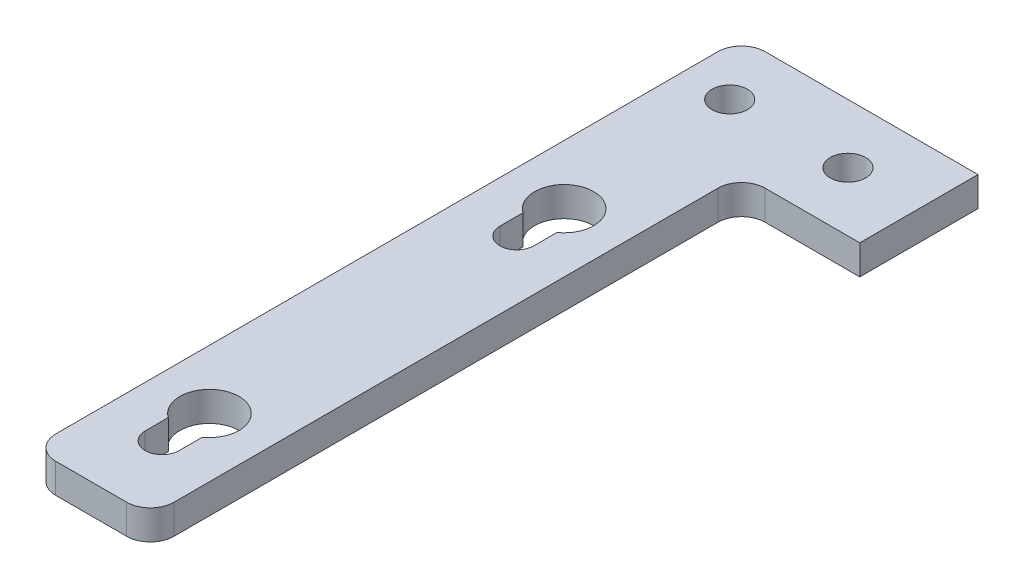
from build123d import *

# Parameters (mm, degrees)
BOSS_EXTRUDE1_DEPTH = 3.175
SKETCH2_R           = 1.905
CUT_EXTRUDE1_DEPTH  = 3.175
FILLET3_R           = 2.54


with BuildPart() as part:
    # Sketch1 → Boss-Extrude1 (new body)
    with BuildSketch(Plane(origin=(0, 0, 0), x_dir=(1, 0, 0), z_dir=(0, 1, 0))):
        Polygon((0, 76.2), (0, 0), (12.7, 0), (12.7, 63.5), (25.4, 63.5), (25.4, 76.2), align=None)
    extrude(amount=BOSS_EXTRUDE1_DEPTH)

    # Sketch2 → Cut-Extrude1 (cut)
    with BuildSketch(Plane(origin=(0, 3.175, 0), x_dir=(1, 0, 0), z_dir=(0, 1, 0))):
        with BuildLine():
            Line((4.5212, 48.204597226), (4.5212, 45.72))
            ThreePointArc((4.5212, 45.72), (6.35, 43.8912), (8.1788, 45.72))
            Line((8.1788, 45.72), (8.1788, 48.204597226))
            ThreePointArc((8.1788, 48.204597226), (6.35, 53.975), (4.5212, 48.204597226))
        make_face()
        with BuildLine():
            Line((4.5212, 10.104597226), (4.5212, 7.62))
            ThreePointArc((4.5212, 7.62), (6.35, 5.7912), (8.1788, 7.62))
            Line((8.1788, 7.62), (8.1788, 10.104597226))
            ThreePointArc((8.1788, 10.104597226), (6.35, 15.875), (4.5212, 10.104597226))
        make_face()
        with Locations((17.78, 69.85)):
            Circle(SKETCH2_R)
        with Locations((5.08, 69.85)):
            Circle(SKETCH2_R)
    extrude(amount=-CUT_EXTRUDE1_DEPTH, mode=Mode.SUBTRACT)

    # Fillet3
    fillet3_edges = [part.edges().sort_by_distance(p)[0] for p in [
        (12.7, 1.5875, -63.5),
        (12.7, 1.5875, 0),
        (0, 1.5875, 0),
        (0, 1.5875, -76.2),
    ]]
    fillet(fillet3_edges, radius=FILLET3_R)


solid = part.part
